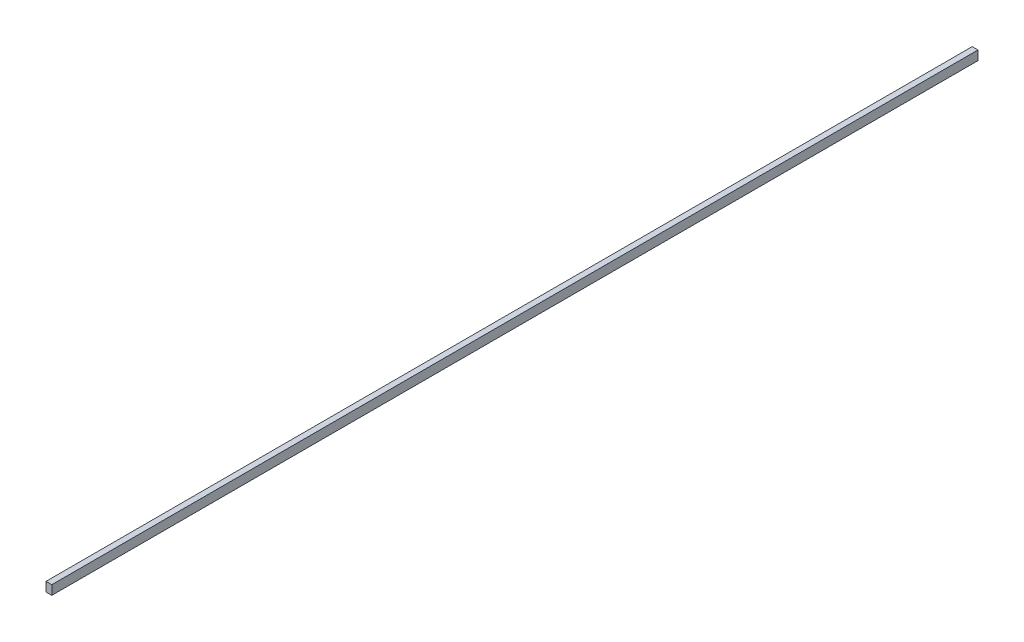
from build123d import *

# Parameters (mm, degrees)
SKETCH1_W           = 50
SKETCH1_H           = 80
BOSS_EXTRUDE1_DEPTH = 8000
SKETCH2_W           = 42
SKETCH2_H           = 72
CUT_EXTRUDE1_DEPTH  = 6000


with BuildPart() as part:
    # Sketch1 → Boss-Extrude1 (new body)
    with BuildSketch(Plane.XY):
        Rectangle(SKETCH1_W, SKETCH1_H)
    extrude(amount=BOSS_EXTRUDE1_DEPTH)

    # Sketch2 → Cut-Extrude1 (cut)
    with BuildSketch(Plane(origin=(0, 0, 0), x_dir=(-1, 0, 0), z_dir=(0, 0, -1))):
        Rectangle(SKETCH2_W, SKETCH2_H)
    extrude(amount=-CUT_EXTRUDE1_DEPTH, mode=Mode.SUBTRACT)


solid = part.part
